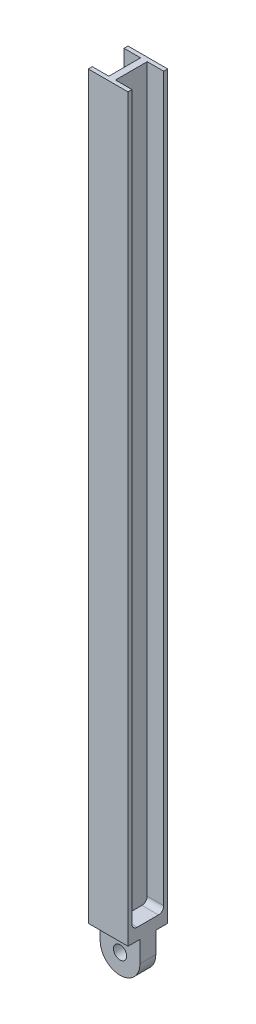
from build123d import *

# Parameters (mm, degrees)
EXTRUDE4_DEPTH     = 550
SKETCH4_W          = 30
SKETCH4_H          = 30
EXTRUDE5_DEPTH     = 40
SKETCH5_W          = 30
SKETCH5_H          = 9
CUT_EXTRUDE2_DEPTH = 31
SKETCH6_R          = 5
CUT_EXTRUDE3_DEPTH = 551.678899178
SKETCH7_OUTSIDE_W  = 150.304
SKETCH7_OUTSIDE_H  = 710.304
CUT_EXTRUDE4_DEPTH = 551.678899178
FILLET2_R          = 4
FILLET3_R          = 4


with BuildPart() as part:
    # Sketch1 → Extrude4 (new body)
    with BuildSketch(Plane(origin=(0, 0, 0), x_dir=(1, 0, 0), z_dir=(0, 1, 0))):
        Polygon((-12.5, 3), (17.5, 3), (17.5, 0), (5, 0), (5, -24), (17.5, -24), (17.5, -27), (-12.5, -27), (-12.5, -24), (0, -24), (0, 0), (-12.5, 0), align=None)
    extrude(amount=EXTRUDE4_DEPTH)

    # Sketch4 → Extrude5 (add)
    with BuildSketch(Plane.XZ):
        with Locations((2.5, 12)):
            Rectangle(SKETCH4_W, SKETCH4_H)
    extrude(amount=EXTRUDE5_DEPTH)

    # Sketch5 → Cut-Extrude2 (cut)
    with BuildSketch(Plane.XZ.offset(40)):
        with Locations((2.5, 1.5)):
            Rectangle(SKETCH5_W, SKETCH5_H)
        with Locations((2.5, 22.5)):
            Rectangle(SKETCH5_W, SKETCH5_H)
    extrude(amount=-CUT_EXTRUDE2_DEPTH, mode=Mode.SUBTRACT)

    # Sketch6 → Cut-Extrude3 (cut, through all)
    with BuildSketch(Plane.XY.offset(18)):
        with Locations((2.5, -25)):
            Circle(SKETCH6_R)
    extrude(amount=-CUT_EXTRUDE3_DEPTH, mode=Mode.SUBTRACT)

    # Sketch7 outside → Cut-Extrude4 (cut, through all)
    with BuildSketch(Plane.XY.offset(18)):
        with Locations((2.5, 255)):
            Rectangle(SKETCH7_OUTSIDE_W, SKETCH7_OUTSIDE_H)
        with BuildLine():
            Line((-12.5, 573.573250903), (17.5, 573.573250903))
            Line((17.5, 573.573250903), (17.5, -25))
            ThreePointArc((17.5, -25), (2.5, -40), (-12.5, -25))
            Line((-12.5, -25), (-12.5, 573.573250903))
        make_face(mode=Mode.SUBTRACT)
    extrude(amount=-CUT_EXTRUDE4_DEPTH, mode=Mode.SUBTRACT)

    # Fillet2
    fillet2_edges = [part.edges().sort_by_distance(p)[0] for p in [
        (11.25, 0, 24),
        (11.25, 0, 0),
    ]]
    fillet(fillet2_edges, radius=FILLET2_R)

    # Fillet3
    fillet3_edges = [part.edges().sort_by_distance(p)[0] for p in [
        (-6.25, 0, 0),
        (-6.25, 0, 24),
    ]]
    fillet(fillet3_edges, radius=FILLET3_R)


solid = part.part
